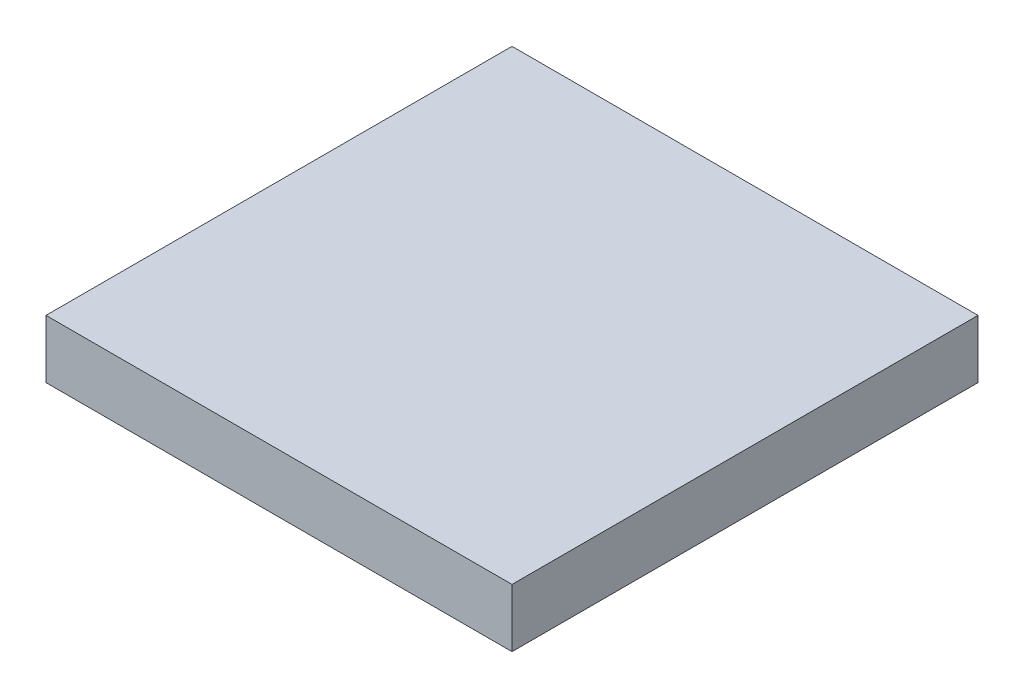
from build123d import *

# Parameters (mm, degrees)
SKETCH1_W           = 2438.4
SKETCH1_H           = 2438.4
BOSS_EXTRUDE1_DEPTH = 304.8


with BuildPart() as part:
    # Sketch1 → Boss-Extrude1 (new body)
    with BuildSketch(Plane(origin=(0, 0, 0), x_dir=(1, 0, 0), z_dir=(0, 1, 0))):
        Rectangle(SKETCH1_W, SKETCH1_H)
    extrude(amount=BOSS_EXTRUDE1_DEPTH)


solid = part.part
